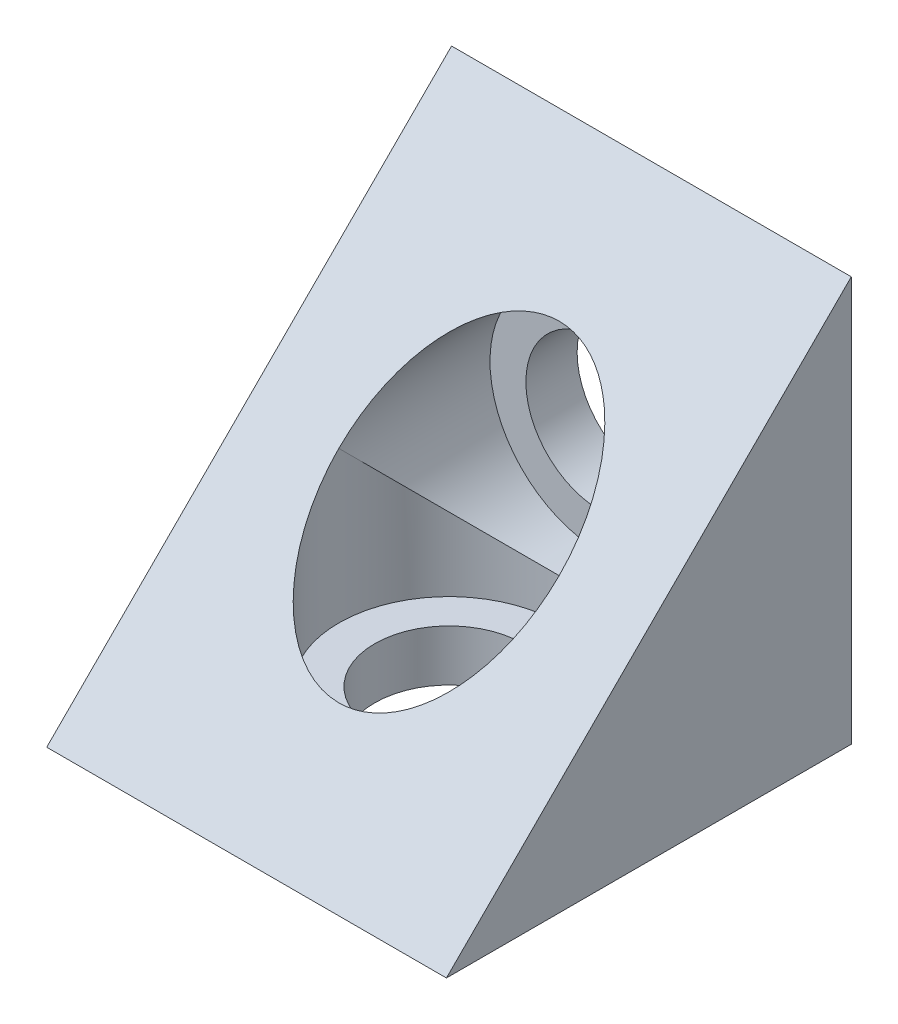
from build123d import *

# Parameters (mm, degrees)
BOSS_EXTRUDE1_DEPTH     = 9.906
CUT_EXTRUDE1_DEPTH      = 18.304652958
CUT_EXTRUDE1_DEPTH_BACK = 7.493
SKETCH2_R               = 5.461
SKETCH2_R_2             = 3.683
SKETCH2_3_R             = 3.683
CUT_EXTRUDE2_DEPTH      = 18.304652958
SKETCH3_R               = 5.461
SKETCH3_R_2             = 3.683
CUT_EXTRUDE3_DEPTH      = 7.493
SKETCH3_4_R             = 3.683
CUT_EXTRUDE4_DEPTH      = 18.304652958


with BuildPart() as part:
    # Sketch1 → Boss-Extrude1 (new, symmetric)
    with BuildSketch(Plane(origin=(0, 0, 0), x_dir=(0, 0, -1), z_dir=(1, 0, 0))):
        Polygon((-10.033, -10.033), (10.033, 10.033), (10.033, -10.033), align=None)
    extrude(amount=BOSS_EXTRUDE1_DEPTH, both=True)

    # Sketch2 → Cut-Extrude1 (cut, two sides: drawn at the far end of the back side and taken through both)
    # profile 1 of 2: a face of its own
    with BuildSketch(Plane(origin=(0, 0, 0), x_dir=(1, 0, 0), z_dir=(0, 1, 0)).offset(-CUT_EXTRUDE1_DEPTH_BACK)):
        with Locations(Location((0, 0, 0), (0, 0, 270))):
            Circle(SKETCH2_R)
        Circle(SKETCH2_R_2, mode=Mode.SUBTRACT)
    # profile 2 of 2: a face of its own
    with BuildSketch(Plane(origin=(0, 0, 0), x_dir=(1, 0, 0), z_dir=(0, 1, 0)).offset(-CUT_EXTRUDE1_DEPTH_BACK)):
        Circle(SKETCH2_R_2)
    extrude(amount=CUT_EXTRUDE1_DEPTH + CUT_EXTRUDE1_DEPTH_BACK, mode=Mode.SUBTRACT)

    # Sketch2<3> → Cut-Extrude2 (cut, through all)
    with BuildSketch(Plane(origin=(0, 0, 0), x_dir=(1, 0, 0), z_dir=(0, 1, 0))):
        with Locations(Location((0, 0, 0), (0, 0, 270))):
            Circle(SKETCH2_3_R)
    extrude(amount=-CUT_EXTRUDE2_DEPTH, mode=Mode.SUBTRACT)

    # Sketch3 → Cut-Extrude3 (cut)
    # profile 1 of 2: a face of its own
    with BuildSketch(Plane.XY):
        Circle(SKETCH3_R)
        Circle(SKETCH3_R_2, mode=Mode.SUBTRACT)
    # profile 2 of 2: a face of its own
    with BuildSketch(Plane.XY):
        Circle(SKETCH3_R_2)
    extrude(amount=-CUT_EXTRUDE3_DEPTH, mode=Mode.SUBTRACT)

    # Sketch3<4> → Cut-Extrude4 (cut, through all)
    with BuildSketch(Plane.XY):
        Circle(SKETCH3_4_R)
    extrude(amount=-CUT_EXTRUDE4_DEPTH, mode=Mode.SUBTRACT)


solid = part.part
